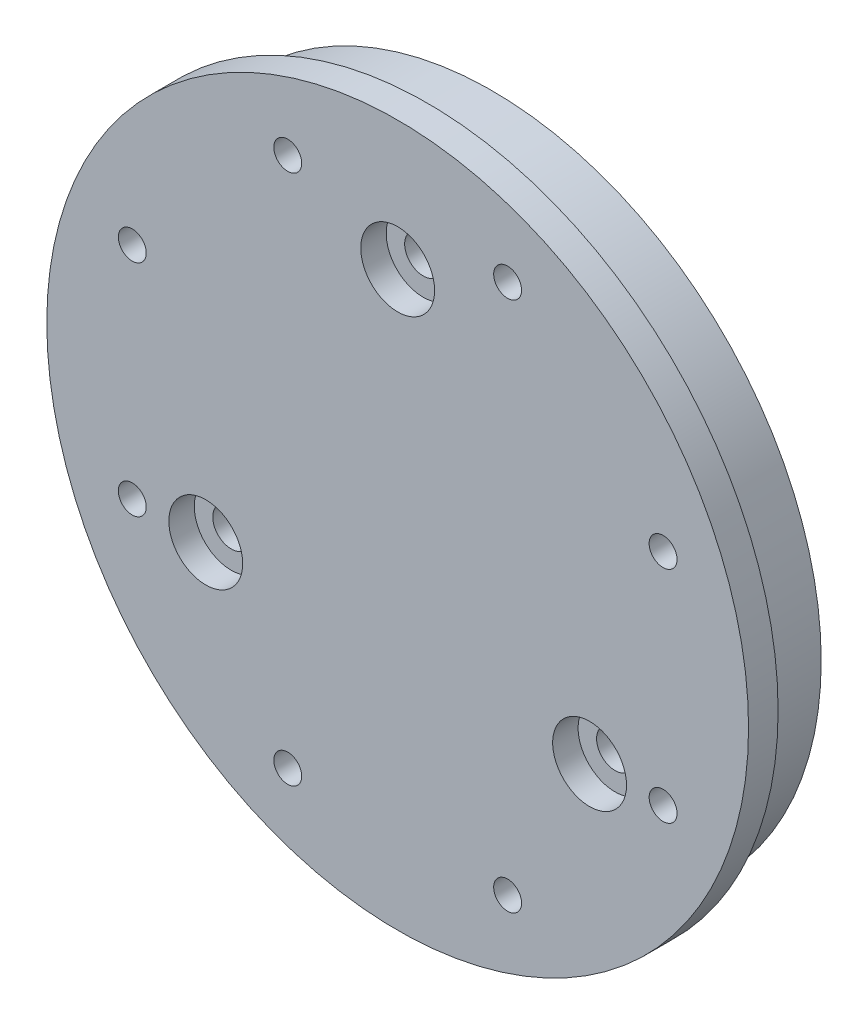
from build123d import *

# Parameters (mm, degrees)
CROQUIS1_R                                           = 40.1
SALIENTE_EXTRUIR1_DEPTH                              = 3.95
CROQUIS2_R                                           = 42.75
SALIENTE_EXTRUIR2_DEPTH                              = 3.6
REFRENTADO_PARA_TORNILLO_CON_CABEZA_TRON_D           = 4.5
REFRENTADO_PARA_TORNILLO_CON_CABEZA_TRON_CBORE_D     = 9
REFRENTADO_PARA_TORNILLO_CON_CABEZA_TRON_CBORE_DEPTH = 3.1
SALIENTE_EXTRUIR3_DEPTH                              = 3.6
TALADRO_DE_MARGEN_PARA_M32_D                         = 3.4


with BuildPart() as part:
    # Croquis1 → Saliente-Extruir1 (new, symmetric)
    with BuildSketch(Plane.XY):
        Circle(CROQUIS1_R)
    extrude(amount=SALIENTE_EXTRUIR1_DEPTH, both=True)

    # Croquis2 → Saliente-Extruir2 (add)
    with BuildSketch(Plane.XY.offset(3.95)):
        Circle(CROQUIS2_R)
    extrude(amount=SALIENTE_EXTRUIR2_DEPTH)

    # Refrentado para tornillo con cabeza troncocónica de M41 (through all)
    with Locations(Plane.XY.offset(7.55)):
        with Locations((0, 27), (23.382685902, -13.5), (-23.382685902, -13.5)):
            CounterBoreHole(REFRENTADO_PARA_TORNILLO_CON_CABEZA_TRON_D / 2, REFRENTADO_PARA_TORNILLO_CON_CABEZA_TRON_CBORE_D / 2, REFRENTADO_PARA_TORNILLO_CON_CABEZA_TRON_CBORE_DEPTH)

    # Croquis6 → Saliente-Extruir3 (add)
    with BuildSketch(Plane(origin=(0, 0, -3.95), x_dir=(-1, 0, 0), z_dir=(0, 0, -1))):
        Polygon((5, 20), (5, 2.886751346), (19.820508076, -5.669872981), (14.820508076, -14.330127019), (0, -5.773502692), (-14.820508076, -14.330127019), (-19.820508076, -5.669872981), (-5, 2.886751346), (-5, 20), align=None)
    extrude(amount=SALIENTE_EXTRUIR3_DEPTH)

    # Taladro de margen para M32 (through all)
    with Locations(Plane.XY.offset(7.55)):
        with Locations((13.393920133, 32.335783638), (32.335783638, 13.393920133), (32.335783638, -13.393920133), (13.393920133, -32.335783638), (-13.393920133, -32.335783638), (-32.335783638, -13.393920133), (-32.335783638, 13.393920133), (-13.393920133, 32.335783638)):
            Hole(TALADRO_DE_MARGEN_PARA_M32_D / 2)


solid = part.part
